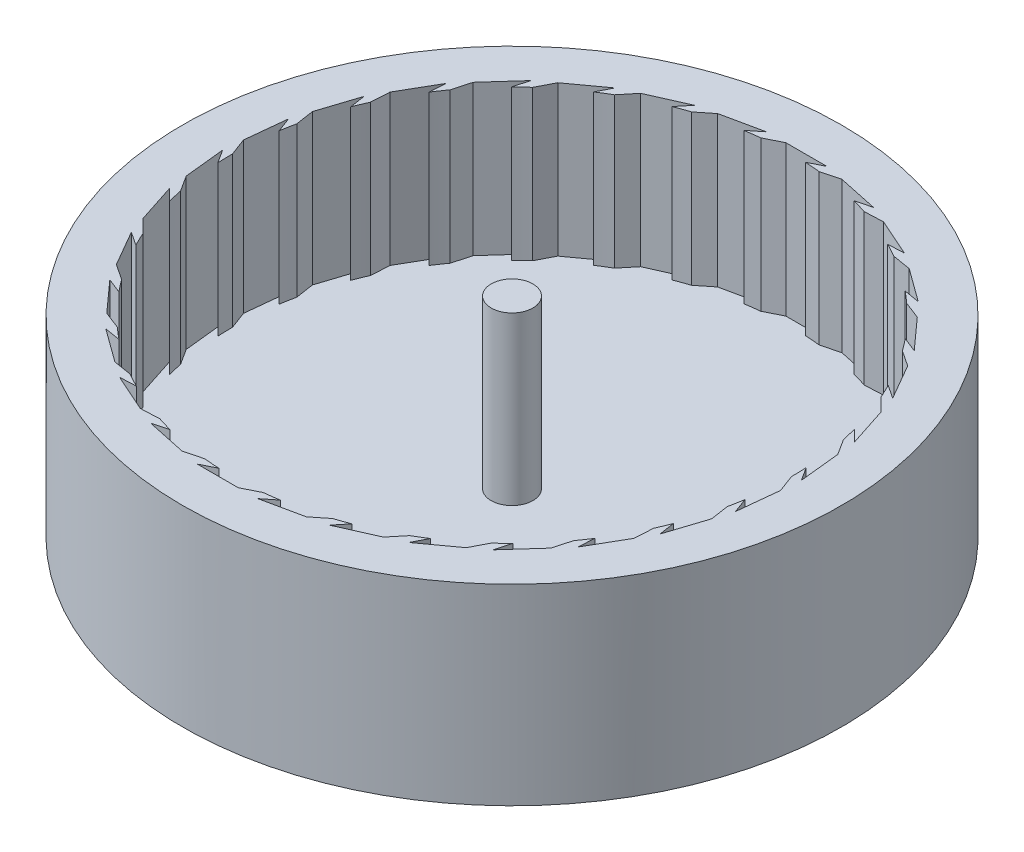
from build123d import *

# Parameters (mm, degrees)
SKETCH1_R           = 39.5
BOSS_EXTRUDE1_DEPTH = 18
BOSS_EXTRUDE2_START = 5
SKETCH2_R           = 39.5
BOSS_EXTRUDE2_DEPTH = 5
SKETCH3_R           = 2.5
BOSS_EXTRUDE3_DEPTH = 20


with BuildPart() as part:
    # Sketch1 → Boss-Extrude1 (new body)
    with BuildSketch(Plane(origin=(0, 0, 0), x_dir=(1, 0, 0), z_dir=(0, 1, 0))):
        with Locations(Location((0, 0, 0), (0, 0, 270))):
            Circle(SKETCH1_R)
        with BuildLine():
            ThreePointArc((-5.301518913, 33.077846018), (-4.402379143, 33.209472412), (-3.5, 33.316662498))
            Line((-3.5, 33.316662498), (-1.5, 34.316662498))
            Line((-1.5, 34.316662498), (3.410400922, 34.316662498))
            Line((3.410400922, 34.316662498), (1.691602889, 33.457263481))
            ThreePointArc((1.691602889, 33.457263481), (2.598460964, 33.399071853), (3.50340703, 33.316304405))
            Line((3.50340703, 33.316304405), (5.667613922, 33.878628624))
            Line((5.667613922, 33.878628624), (10.470710803, 32.857698865))
            Line((10.470710803, 32.857698865), (8.610793528, 32.374437985))
            ThreePointArc((8.610793528, 32.374437985), (9.485735858, 32.128971587), (10.353698361, 31.85986394))
            Line((10.353698361, 31.85986394), (12.58752592, 31.959936111))
            Line((12.58752592, 31.959936111), (17.073400377, 29.962696124))
            Line((17.073400377, 29.962696124), (15.153651171, 29.876694198))
            ThreePointArc((15.153651171, 29.876694198), (15.958438578, 29.454681091), (16.751483392, 29.01099454))
            Line((16.751483392, 29.01099454), (18.957302633, 28.644441029))
            Line((18.957302633, 28.644441029), (22.929900428, 25.758179785))
            Line((22.929900428, 25.758179785), (21.034221542, 26.073195511))
            ThreePointArc((21.034221542, 26.073195511), (21.733680954, 25.493079692), (22.417148215, 24.894205468))
            Line((22.417148215, 24.894205468), (24.498554253, 24.077046424))
            Line((24.498554253, 24.077046424), (27.7842538, 20.427907387))
            Line((27.7842538, 20.427907387), (25.995495498, 21.130173066))
            ThreePointArc((25.995495498, 21.130173066), (26.559057183, 20.417308381), (27.103076093, 19.689420162))
            Line((27.103076093, 19.689420162), (28.969101496, 18.457369355))
            Line((28.969101496, 18.457369355), (31.424301957, 14.204837413))
            Line((31.424301957, 14.204837413), (29.820641561, 15.263660665))
            ThreePointArc((29.820641561, 15.263660665), (30.223675169, 14.449202721), (30.60446949, 13.624112715))
            Line((30.60446949, 13.624112715), (32.173559995, 12.031016677))
            Line((32.173559995, 12.031016677), (33.690957329, 7.360947882))
            Line((33.690957329, 7.360947882), (32.342482492, 8.73005305))
            ThreePointArc((32.342482492, 8.73005305), (32.567373521, 7.849597567), (32.768300713, 6.963366166))
            Line((32.768300713, 6.963366166), (33.971879535, 5.078850838))
            Line((33.971879535, 5.078850838), (34.485156198, 0.195349606))
            Line((34.485156198, 0.195349606), (33.450801742, 1.814900225))
            ThreePointArc((33.450801742, 1.814900225), (33.487698177, 0.907783468), (33.5, 0))
            ThreePointArc((33.5, 0), (33.499999989, -0.000856449), (33.499999956, -0.001712898))
            Line((33.499999956, -0.001712898), (34.285464925, -2.095285152))
            Line((34.285464925, -2.095285152), (33.772188263, -6.978786385))
            Line((33.772188263, -6.978786385), (33.097160441, -5.179572449))
            ThreePointArc((33.097160441, -5.179572449), (32.944495111, -6.075379978), (32.76758845, -6.966717101))
            Line((32.76758845, -6.966717101), (33.100610978, -9.177847128))
            Line((33.100610978, -9.177847128), (31.583213644, -13.847915922))
            Line((31.583213644, -13.847915922), (31.297014411, -11.947672952))
            ThreePointArc((31.297014411, -11.947672952), (30.961436327, -12.792164031), (30.603076093, -13.627242336))
            Line((30.603076093, -13.627242336), (30.469101496, -15.859293143))
            Line((30.469101496, -15.859293143), (28.013901035, -20.111825085))
            Line((28.013901035, -20.111825085), (28.129038671, -18.193602816))
            ThreePointArc((28.129038671, -18.193602816), (27.625214205, -18.949869132), (27.10106246, -19.69219169))
            Line((27.10106246, -19.69219169), (26.505946073, -21.847611947))
            Line((26.505946073, -21.847611947), (23.220246526, -25.496750984))
            Line((23.220246526, -25.496750984), (23.731688964, -23.644384934))
            ThreePointArc((23.731688964, -23.644384934), (23.081637663, -24.27937402), (22.414602352, -24.896497774))
            Line((22.414602352, -24.896497774), (21.384353616, -26.881085273))
            Line((21.384353616, -26.881085273), (17.41175582, -29.767346518))
            Line((17.41175582, -29.767346518), (18.297150571, -28.061793973))
            ThreePointArc((18.297150571, -28.061793973), (17.529282796, -28.547753758), (16.748516565, -29.012707438))
            Line((16.748516565, -29.012707438), (15.328162292, -30.739726182))
            Line((15.328162292, -30.739726182), (10.842287835, -32.736966169))
            Line((10.842287835, -32.736966169), (12.062938899, -31.252767959))
            ThreePointArc((12.062938899, -31.252767959), (11.210814157, -31.56845967), (10.350440235, -31.860922569))
            Line((10.350440235, -31.860922569), (8.602056724, -33.254893551))
            Line((8.602056724, -33.254893551), (3.798959843, -34.27582331))
            Line((3.798959843, -34.27582331), (5.301518913, -33.077846018))
            ThreePointArc((5.301518913, -33.077846018), (4.402379143, -33.209472412), (3.5, -33.316662498))
            Line((3.5, -33.316662498), (1.5, -34.316662498))
            Line((1.5, -34.316662498), (-3.410400922, -34.316662498))
            Line((-3.410400922, -34.316662498), (-1.691602889, -33.457263481))
            ThreePointArc((-1.691602889, -33.457263481), (-2.598460964, -33.399071853), (-3.50340703, -33.316304405))
            Line((-3.50340703, -33.316304405), (-5.667613922, -33.878628624))
            Line((-5.667613922, -33.878628624), (-10.470710803, -32.857698865))
            Line((-10.470710803, -32.857698865), (-8.610793528, -32.374437985))
            ThreePointArc((-8.610793528, -32.374437985), (-9.485735858, -32.128971587), (-10.353698361, -31.85986394))
            Line((-10.353698361, -31.85986394), (-12.587525919, -31.959936111))
            Line((-12.587525919, -31.959936111), (-17.073400377, -29.962696124))
            Line((-17.073400377, -29.962696124), (-15.153651171, -29.876694198))
            ThreePointArc((-15.153651171, -29.876694198), (-15.958438577, -29.454681091), (-16.751483392, -29.01099454))
            Line((-16.751483392, -29.01099454), (-18.957302633, -28.644441029))
            Line((-18.957302633, -28.644441029), (-22.929900428, -25.758179785))
            Line((-22.929900428, -25.758179785), (-21.034221542, -26.073195511))
            ThreePointArc((-21.034221542, -26.073195511), (-21.733680954, -25.493079692), (-22.417148215, -24.894205468))
            Line((-22.417148215, -24.894205468), (-24.498554253, -24.077046424))
            Line((-24.498554253, -24.077046424), (-27.7842538, -20.427907387))
            Line((-27.7842538, -20.427907387), (-25.995495498, -21.130173066))
            ThreePointArc((-25.995495498, -21.130173066), (-26.559057183, -20.417308381), (-27.103076092, -19.689420162))
            Line((-27.103076092, -19.689420162), (-28.969101496, -18.457369355))
            Line((-28.969101496, -18.457369355), (-31.424301957, -14.204837413))
            Line((-31.424301957, -14.204837413), (-29.820641561, -15.263660665))
            ThreePointArc((-29.820641561, -15.263660665), (-30.223675169, -14.449202721), (-30.60446949, -13.624112715))
            Line((-30.60446949, -13.624112715), (-32.173559995, -12.031016677))
            Line((-32.173559995, -12.031016677), (-33.690957329, -7.360947882))
            Line((-33.690957329, -7.360947882), (-32.342482492, -8.73005305))
            ThreePointArc((-32.342482492, -8.73005305), (-32.567373521, -7.849597567), (-32.768300713, -6.963366166))
            Line((-32.768300713, -6.963366166), (-33.971879535, -5.078850838))
            Line((-33.971879535, -5.078850838), (-34.485156198, -0.195349606))
            Line((-34.485156198, -0.195349606), (-33.450801742, -1.814900225))
            ThreePointArc((-33.450801742, -1.814900225), (-33.487721374, -0.906927333), (-33.499999956, 0.001712898))
            Line((-33.499999956, 0.001712898), (-34.285464925, 2.095285152))
            Line((-34.285464925, 2.095285152), (-33.772188263, 6.978786385))
            Line((-33.772188263, 6.978786385), (-33.097160441, 5.179572449))
            ThreePointArc((-33.097160441, 5.179572449), (-32.944495111, 6.075379978), (-32.76758845, 6.966717101))
            Line((-32.76758845, 6.966717101), (-33.100610978, 9.177847128))
            Line((-33.100610978, 9.177847128), (-31.583213644, 13.847915922))
            Line((-31.583213644, 13.847915922), (-31.297014411, 11.947672952))
            ThreePointArc((-31.297014411, 11.947672952), (-30.961436327, 12.792164031), (-30.603076093, 13.627242336))
            Line((-30.603076092, 13.627242336), (-30.469101496, 15.859293143))
            Line((-30.469101496, 15.859293143), (-28.013901035, 20.111825085))
            Line((-28.013901035, 20.111825085), (-28.129038671, 18.193602816))
            ThreePointArc((-28.129038671, 18.193602816), (-27.625214205, 18.949869132), (-27.10106246, 19.69219169))
            Line((-27.10106246, 19.69219169), (-26.505946073, 21.847611947))
            Line((-26.505946073, 21.847611947), (-23.220246526, 25.496750984))
            Line((-23.220246526, 25.496750984), (-23.731688964, 23.644384934))
            ThreePointArc((-23.731688964, 23.644384934), (-23.081637663, 24.27937402), (-22.414602352, 24.896497774))
            Line((-22.414602352, 24.896497774), (-21.384353616, 26.881085273))
            Line((-21.384353616, 26.881085273), (-17.41175582, 29.767346518))
            Line((-17.41175582, 29.767346518), (-18.297150571, 28.061793973))
            ThreePointArc((-18.297150571, 28.061793973), (-17.529282796, 28.547753758), (-16.748516565, 29.012707438))
            Line((-16.748516565, 29.012707438), (-15.328162292, 30.739726182))
            Line((-15.328162292, 30.739726182), (-10.842287835, 32.736966169))
            Line((-10.842287835, 32.736966169), (-12.062938899, 31.252767959))
            ThreePointArc((-12.062938899, 31.252767959), (-11.210814157, 31.56845967), (-10.350440235, 31.860922569))
            Line((-10.350440235, 31.860922569), (-8.602056724, 33.254893551))
            Line((-8.602056724, 33.254893551), (-3.798959843, 34.27582331))
            Line((-3.798959843, 34.27582331), (-5.301518913, 33.077846018))
        make_face(mode=Mode.SUBTRACT)
    extrude(amount=BOSS_EXTRUDE1_DEPTH)

    # Sketch2 → Boss-Extrude2 (add)
    with BuildSketch(Plane(origin=(0, 0, 0), x_dir=(-1, 0, 0), z_dir=(0, -1, 0)).offset(BOSS_EXTRUDE2_START)):
        with Locations(Location((0, 0, 0), (0, 0, 90))):
            Circle(SKETCH2_R)
    extrude(amount=-BOSS_EXTRUDE2_DEPTH)

    # Sketch3 → Boss-Extrude3 (add)
    with BuildSketch(Plane(origin=(0, 0, 0), x_dir=(1, 0, 0), z_dir=(0, 1, 0))):
        with Locations(Location((0, 0, 0), (0, 0, 90))):
            Circle(SKETCH3_R)
    extrude(amount=BOSS_EXTRUDE3_DEPTH)


solid = part.part
